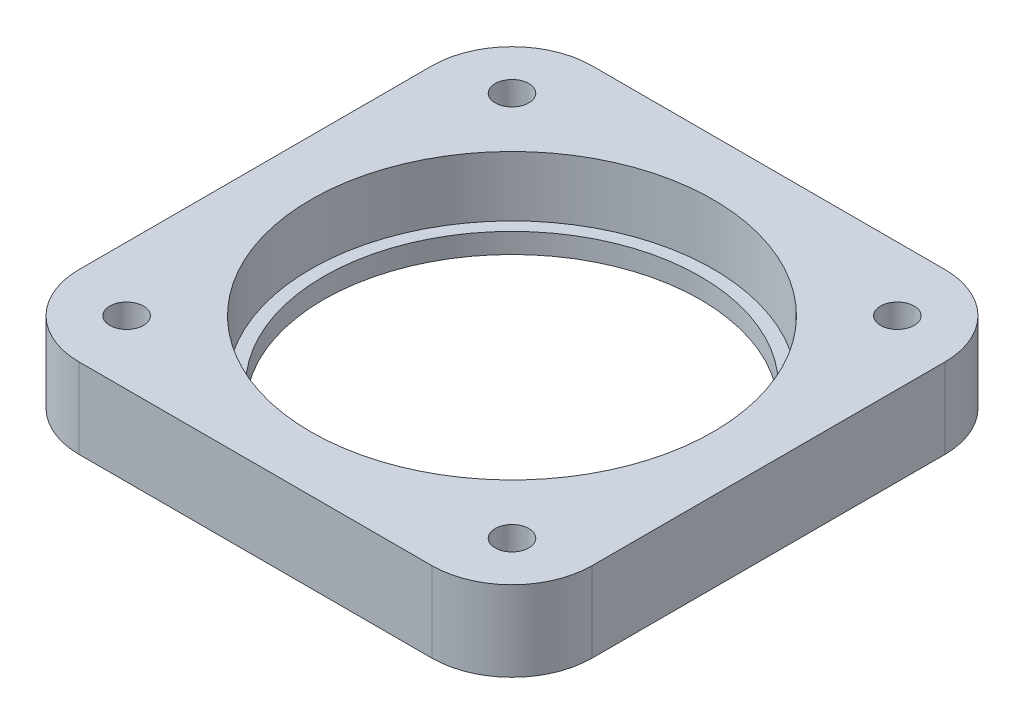
from build123d import *

# Parameters (mm, degrees)
SKETCH_1_W          = 64
SKETCH_1_H          = 64
SKETCH_1_R          = 23.5
EXTRUDE_1_DEPTH     = 2.5
SKETCH_2_W          = 64
SKETCH_2_H          = 64
SKETCH_2_R          = 25.1
EXTRUDE_2_DEPTH     = 7.5
SKETCH_3_R          = 2.1
CUT_EXTRUDE_1_DEPTH = 20
FILLET_1_R          = 10


with BuildPart() as part:
    # 草图1 → 凸台-拉伸1 (new body)
    with BuildSketch(Plane(origin=(0, 0, 0), x_dir=(1, 0, 0), z_dir=(0, 1, 0))):
        Rectangle(SKETCH_1_W, SKETCH_1_H)
        with Locations(Location((0, 0, 0), (0, 0, 270))):
            Circle(SKETCH_1_R, mode=Mode.SUBTRACT)
    extrude(amount=EXTRUDE_1_DEPTH)

    # 草图2 → 凸台-拉伸2 (add)
    with BuildSketch(Plane(origin=(0, 2.5, 0), x_dir=(1, 0, 0), z_dir=(0, 1, 0))):
        Rectangle(SKETCH_2_W, SKETCH_2_H)
        with Locations(Location((0, 0, 0), (0, 0, 270))):
            Circle(SKETCH_2_R, mode=Mode.SUBTRACT)
    extrude(amount=EXTRUDE_2_DEPTH)

    # 草图3 → 切除-拉伸1 (cut)
    with BuildSketch(Plane(origin=(0, 10, 0), x_dir=(1, 0, 0), z_dir=(0, 1, 0))):
        with Locations(Location((24.04163056, 24.04163056, 0), (0, 0, 270))):
            Circle(SKETCH_3_R)
        with Locations(Location((24.04163056, -24.04163056, 0), (0, 0, 270))):
            Circle(SKETCH_3_R)
        with Locations(Location((-24.04163056, -24.04163056, 0), (0, 0, 270))):
            Circle(SKETCH_3_R)
        with Locations(Location((-24.04163056, 24.04163056, 0), (0, 0, 270))):
            Circle(SKETCH_3_R)
    extrude(amount=-CUT_EXTRUDE_1_DEPTH, mode=Mode.SUBTRACT)

    # 圆角1
    fillet_1_edges = [part.edges().sort_by_distance(p)[0] for p in [
        (32, 5, 32),
        (-32, 5, 32),
        (-32, 5, -32),
        (32, 5, -32),
    ]]
    fillet(fillet_1_edges, radius=FILLET_1_R)


solid = part.part
